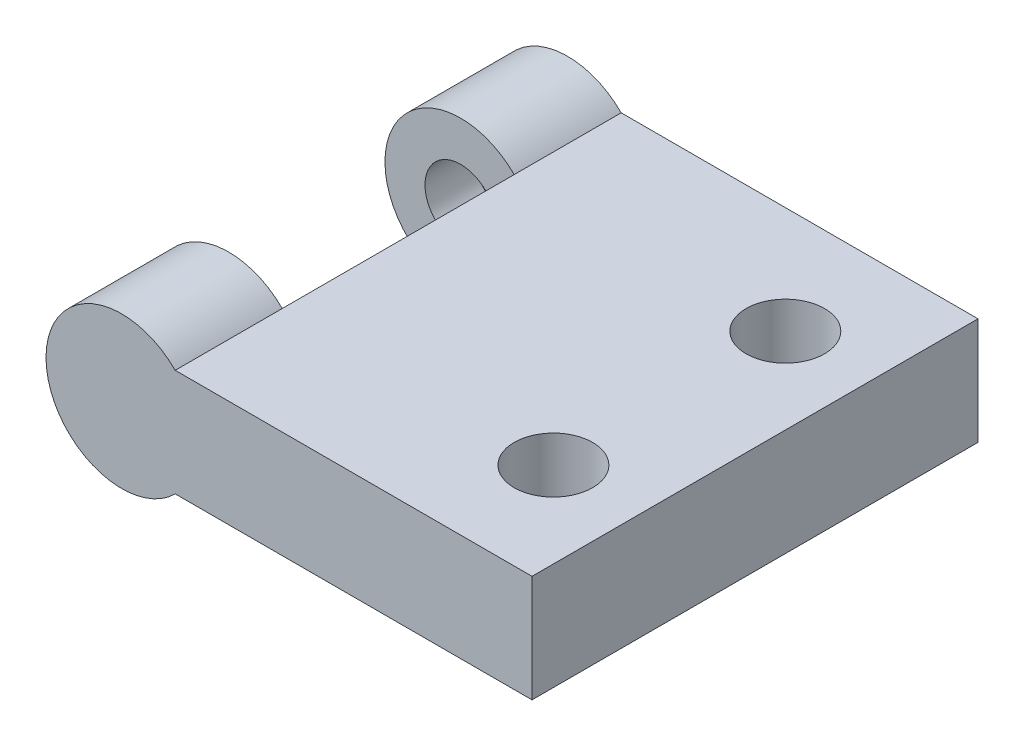
from build123d import *

# Parameters (mm, degrees)
SKETCH2_W           = 12.7
SKETCH2_H           = 15.875
BOSS_EXTRUDE1_DEPTH = 3.81
SKETCH3_R           = 1.397
CUT_EXTRUDE1_DEPTH  = 3.81
SKETCH6_R           = 2.694076836
BOSS_EXTRUDE2_DEPTH = 3.81
SKETCH8_R           = 1.27
CUT_EXTRUDE3_DEPTH  = 1.778
BOSS_EXTRUDE3_START = -3.81
SKETCH9_R           = 2.694076836
BOSS_EXTRUDE3_DEPTH = 3.81
CUT_EXTRUDE4_START  = -1.778
SKETCH10_R          = 1.27
CUT_EXTRUDE4_DEPTH  = 1.778


with BuildPart() as part:
    # Sketch2 → Boss-Extrude1 (new body)
    with BuildSketch(Plane(origin=(0, 0, 0), x_dir=(1, 0, 0), z_dir=(0, 1, 0))):
        with Locations((6.35, 7.9375)):
            Rectangle(SKETCH2_W, SKETCH2_H)
    extrude(amount=BOSS_EXTRUDE1_DEPTH)

    # Sketch3 → Cut-Extrude1 (cut)
    with BuildSketch(Plane(origin=(0, 3.81, 0), x_dir=(1, 0, 0), z_dir=(0, 1, 0))):
        with Locations(Location((9.652, 3.81, 0), (0, 0, 270))):
            Circle(SKETCH3_R)
        with Locations(Location((9.652, 12.065, 0), (0, 0, 270))):
            Circle(SKETCH3_R)
    extrude(amount=-CUT_EXTRUDE1_DEPTH, mode=Mode.SUBTRACT)

    # Sketch6 → Boss-Extrude2 (add)
    with BuildSketch(Plane.XY):
        with Locations((-1.905, 1.905)):
            Circle(SKETCH6_R)
    extrude(amount=-BOSS_EXTRUDE2_DEPTH)

    # Sketch8 → Cut-Extrude3 (cut)
    with BuildSketch(Plane(origin=(0, 0, -3.81), x_dir=(-1, 0, 0), z_dir=(0, 0, -1))):
        with Locations((1.905, 1.905)):
            Circle(SKETCH8_R)
    extrude(amount=-CUT_EXTRUDE3_DEPTH, mode=Mode.SUBTRACT)

    # Sketch9 → Boss-Extrude3 (add)
    with BuildSketch(Plane(origin=(0, 0, -15.875), x_dir=(-1, 0, 0), z_dir=(0, 0, -1)).offset(BOSS_EXTRUDE3_START)):
        with Locations((1.905, 1.905)):
            Circle(SKETCH9_R)
    extrude(amount=BOSS_EXTRUDE3_DEPTH)

    # Sketch10 → Cut-Extrude4 (cut)
    with BuildSketch(Plane.XY.offset(-12.065).offset(CUT_EXTRUDE4_START)):
        with Locations(Location((-1.905, 1.905, 0), (0, 0, 180))):
            Circle(SKETCH10_R)
    extrude(amount=CUT_EXTRUDE4_DEPTH, mode=Mode.SUBTRACT)


solid = part.part
